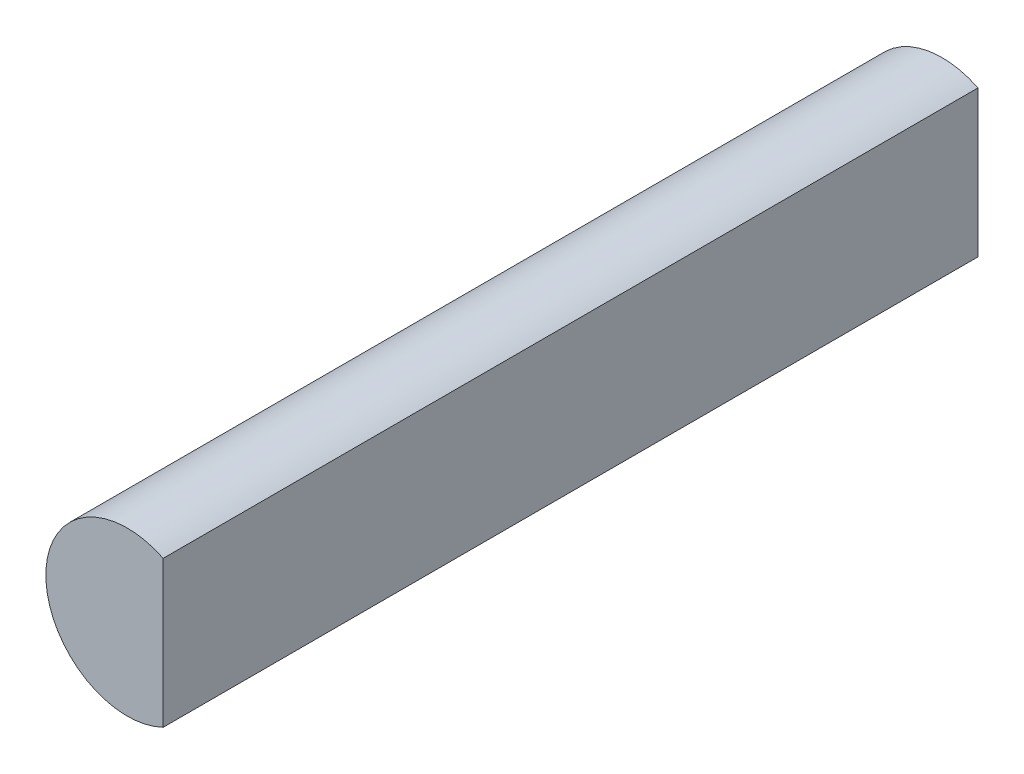
from build123d import *

# Parameters (mm, degrees)
EXTRUDE_1_DEPTH = 10


with BuildPart() as part:
    # 草图1 → 凸台-拉伸1 (new body)
    with BuildSketch(Plane.XY):
        with BuildLine():
            Line((0.44, 0.897997773), (0.44, -0.897997773))
            ThreePointArc((0.44, -0.897997773), (-1, 0), (0.44, 0.897997773))
        make_face()
    extrude(amount=EXTRUDE_1_DEPTH)


solid = part.part
